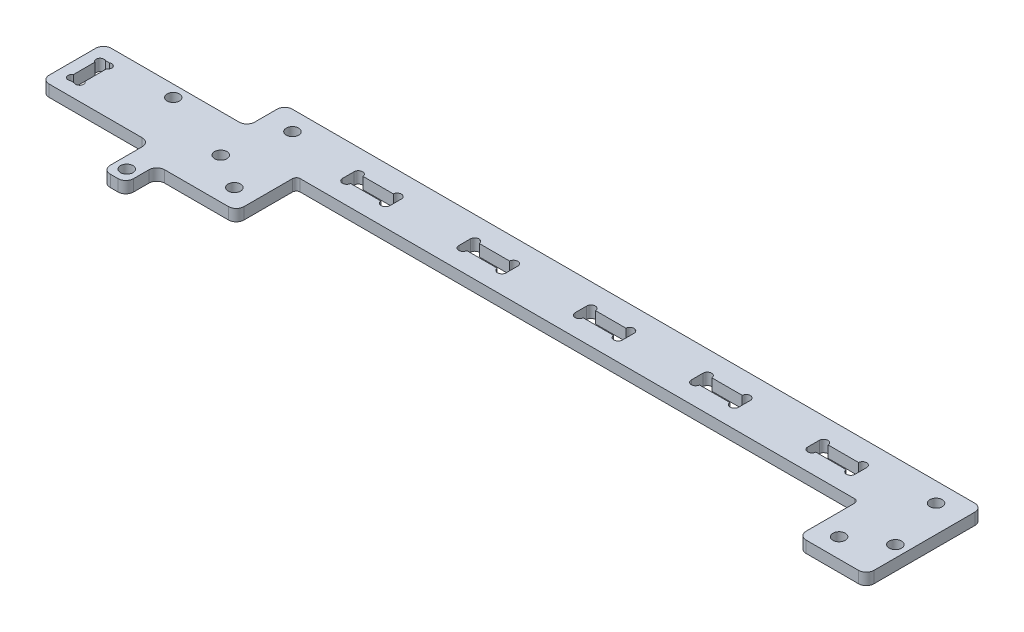
from build123d import *

# Parameters (mm, degrees)
SKETCH_1_R          = 1.6
EXTRUDE_1_DEPTH     = 3
SKETCH_3_R          = 1.6
CUT_EXTRUDE_1_DEPTH = 92.290744328
FILLET_1_R          = 1
SKETCH_4_W          = 12
SKETCH_4_H          = 3
CUT_EXTRUDE_2_DEPTH = 92.290744328
SKETCH_5_R          = 1
CUT_EXTRUDE_3_DEPTH = 92.290744328
CUT_EXTRUDE_4_DEPTH = 92.290744328
SKETCH_7_R          = 1.6
SKETCH_7_W          = 3
SKETCH_7_H          = 9
EXTRUDE_2_DEPTH     = 3
FILLET_3_R          = 2
SKETCH_8_R          = 1
CUT_EXTRUDE_5_DEPTH = 130.100735862


with BuildPart() as part:
    # 草图1 → 凸台-拉伸1 (new body)
    with BuildSketch(Plane(origin=(0, 0, 0), x_dir=(1, 0, 0), z_dir=(0, 1, 0))):
        Polygon((-90, -15), (-72.5, -15), (-72.5, 0.5), (72.5, 0.5), (72.5, -15), (90, -15), (90, 15), (-90, 15), align=None)
        with Locations(Location((78, -10, 0), (0, 0, 270))):
            Circle(SKETCH_1_R, mode=Mode.SUBTRACT)
        with Locations(Location((-78, -10, 0), (0, 0, 90))):
            Circle(SKETCH_1_R, mode=Mode.SUBTRACT)
        with Locations(Location((-83, 10, 0), (0, 0, 270))):
            Circle(SKETCH_1_R, mode=Mode.SUBTRACT)
        with Locations(Location((83, 10, 0), (0, 0, 90))):
            Circle(SKETCH_1_R, mode=Mode.SUBTRACT)
    extrude(amount=EXTRUDE_1_DEPTH)

    # 草图3 → 切除-拉伸1 (cut, through all)
    with BuildSketch(Plane(origin=(0, 3, 0), x_dir=(1, 0, 0), z_dir=(0, 1, 0))):
        with Locations(Location((87, -4.5, 0), (0, 0, 90))):
            Circle(SKETCH_3_R)
        with Locations(Location((-87, -4.5, 0), (0, 0, 270))):
            Circle(SKETCH_3_R)
    extrude(amount=-CUT_EXTRUDE_1_DEPTH, mode=Mode.SUBTRACT)

    # 圆角1
    fillet_1_edges = [part.edges().sort_by_distance(p)[0] for p in [
        (72.5, 1.5, -0.5),
        (-72.5, 1.5, -0.5),
    ]]
    fillet(fillet_1_edges, radius=FILLET_1_R)

    # 草图4 → 切除-拉伸2 (cut, through all)
    with BuildSketch(Plane.XZ):
        with Locations((60, -7.5)):
            Rectangle(SKETCH_4_W, SKETCH_4_H)
        with Locations((30, -7.5)):
            Rectangle(SKETCH_4_W, SKETCH_4_H)
        with Locations((0, -7.5)):
            Rectangle(SKETCH_4_W, SKETCH_4_H)
        with Locations((-30, -7.5)):
            Rectangle(SKETCH_4_W, SKETCH_4_H)
        with Locations((-60, -7.5)):
            Rectangle(SKETCH_4_W, SKETCH_4_H)
    extrude(amount=-CUT_EXTRUDE_2_DEPTH, mode=Mode.SUBTRACT)

    # 草图5 → 切除-拉伸3 (cut, through all)
    with BuildSketch(Plane.XZ):
        with Locations((65, -9)):
            Circle(SKETCH_5_R)
        with Locations((55, -9)):
            Circle(SKETCH_5_R)
        with Locations((55, -6)):
            Circle(SKETCH_5_R)
        with Locations((65, -6)):
            Circle(SKETCH_5_R)
        with Locations((35, -9)):
            Circle(SKETCH_5_R)
        with Locations((25, -9)):
            Circle(SKETCH_5_R)
        with Locations((25, -6)):
            Circle(SKETCH_5_R)
        with Locations((35, -6)):
            Circle(SKETCH_5_R)
        with Locations((5, -9)):
            Circle(SKETCH_5_R)
        with Locations((-5, -9)):
            Circle(SKETCH_5_R)
        with Locations((-5, -6)):
            Circle(SKETCH_5_R)
        with Locations((5, -6)):
            Circle(SKETCH_5_R)
        with Locations((-25, -9)):
            Circle(SKETCH_5_R)
        with Locations((-35, -9)):
            Circle(SKETCH_5_R)
        with Locations((-35, -6)):
            Circle(SKETCH_5_R)
        with Locations((-25, -6)):
            Circle(SKETCH_5_R)
        with Locations((-55, -9)):
            Circle(SKETCH_5_R)
        with Locations((-65, -9)):
            Circle(SKETCH_5_R)
        with Locations((-65, -6)):
            Circle(SKETCH_5_R)
        with Locations((-55, -6)):
            Circle(SKETCH_5_R)
    extrude(amount=-CUT_EXTRUDE_3_DEPTH, mode=Mode.SUBTRACT)

    # 草图6 → 切除-拉伸4 (cut, through all)
    with BuildSketch(Plane.XZ):
        with BuildLine():
            Line((36.1, -9), (36.1, -6))
            ThreePointArc((36.1, -6), (35.050051841, -4.901139311), (33.904554885, -5.9))
            Line((33.904554885, -5.9), (26.095445115, -5.9))
            ThreePointArc((26.095445115, -5.9), (24.949948159, -4.901139311), (23.9, -6))
            Line((23.9, -6), (23.9, -9))
            ThreePointArc((23.9, -9), (24.949948159, -10.098860689), (26.095445115, -9.1))
            Line((26.095445115, -9.1), (33.904554885, -9.1))
            ThreePointArc((33.904554885, -9.1), (35.050051841, -10.098860689), (36.1, -9))
        make_face()
        with BuildLine():
            Line((66.1, -9), (66.1, -6))
            ThreePointArc((66.1, -6), (65.050051841, -4.901139311), (63.904554885, -5.9))
            Line((63.904554885, -5.9), (56.095445115, -5.9))
            ThreePointArc((56.095445115, -5.9), (54.949948159, -4.901139311), (53.9, -6))
            Line((53.9, -6), (53.9, -9))
            ThreePointArc((53.9, -9), (54.949948159, -10.098860689), (56.095445115, -9.1))
            Line((56.095445115, -9.1), (63.904554885, -9.1))
            ThreePointArc((63.904554885, -9.1), (65.050051841, -10.098860689), (66.1, -9))
        make_face()
        with BuildLine():
            Line((6.1, -9), (6.1, -6))
            ThreePointArc((6.1, -6), (5.050051841, -4.901139311), (3.904554885, -5.9))
            Line((3.904554885, -5.9), (-3.904554885, -5.9))
            ThreePointArc((-3.904554885, -5.9), (-5.050051841, -4.901139311), (-6.1, -6))
            Line((-6.1, -6), (-6.1, -9))
            ThreePointArc((-6.1, -9), (-5.050051841, -10.098860689), (-3.904554885, -9.1))
            Line((-3.904554885, -9.1), (3.904554885, -9.1))
            ThreePointArc((3.904554885, -9.1), (5.050051841, -10.098860689), (6.1, -9))
        make_face()
        with BuildLine():
            Line((-23.9, -9), (-23.9, -6))
            ThreePointArc((-23.9, -6), (-24.949948159, -4.901139311), (-26.095445115, -5.9))
            Line((-26.095445115, -5.9), (-33.904554885, -5.9))
            ThreePointArc((-33.904554885, -5.9), (-35.050051841, -4.901139311), (-36.1, -6))
            Line((-36.1, -6), (-36.1, -9))
            ThreePointArc((-36.1, -9), (-35.050051841, -10.098860689), (-33.904554885, -9.1))
            Line((-33.904554885, -9.1), (-26.095445115, -9.1))
            ThreePointArc((-26.095445115, -9.1), (-24.949948159, -10.098860689), (-23.9, -9))
        make_face()
        with BuildLine():
            Line((-53.9, -9), (-53.9, -6))
            ThreePointArc((-53.9, -6), (-54.949948159, -4.901139311), (-56.095445115, -5.9))
            Line((-56.095445115, -5.9), (-63.904554885, -5.9))
            ThreePointArc((-63.904554885, -5.9), (-65.050051841, -4.901139311), (-66.1, -6))
            Line((-66.1, -6), (-66.1, -9))
            ThreePointArc((-66.1, -9), (-65.050051841, -10.098860689), (-63.904554885, -9.1))
            Line((-63.904554885, -9.1), (-56.095445115, -9.1))
            ThreePointArc((-56.095445115, -9.1), (-54.949948159, -10.098860689), (-53.9, -9))
        make_face()
    extrude(amount=-CUT_EXTRUDE_4_DEPTH, mode=Mode.SUBTRACT)

    # 草图7 → 凸台-拉伸2 (add)
    with BuildSketch(Plane.XZ):
        Polygon((-90, -5.25), (-90, 15), (-93, 15), (-93, 23), (-99, 23), (-99, 10.75), (-127, 10.75), (-127, -5.25), align=None)
        with Locations(Location((-96, 19.75, 0), (0, 0, 270))):
            Circle(SKETCH_7_R, mode=Mode.SUBTRACT)
        with Locations(Location((-106, -2.25, 0), (0, 0, 270))):
            Circle(SKETCH_7_R, mode=Mode.SUBTRACT)
        with Locations((-122.5, 2.75)):
            Rectangle(SKETCH_7_W, SKETCH_7_H, mode=Mode.SUBTRACT)
    extrude(amount=-EXTRUDE_2_DEPTH)

    # 圆角3
    fillet_3_edges = [part.edges().sort_by_distance(p)[0] for p in [
        (90, 1.5, 15),
        (72.5, 1.5, 15),
        (-72.5, 1.5, 15),
        (-90, 1.5, -15),
        (90, 1.5, -15),
        (-93, 1.5, 15),
        (-93, 1.5, 23),
        (-99, 1.5, 23),
        (-99, 1.5, 10.75),
        (-127, 1.5, 10.75),
        (-127, 1.5, -5.25),
        (-90, 1.5, -5.25),
    ]]
    fillet(fillet_3_edges, radius=FILLET_3_R)

    # 草图8 → 切除-拉伸5 (cut, through all)
    with BuildSketch(Plane(origin=(0, 3, 0), x_dir=(1, 0, 0), z_dir=(0, 1, 0))):
        with Locations((-123.5025, 0.882536024)):
            Circle(SKETCH_8_R)
        with Locations((-121.4975, 0.882536024)):
            Circle(SKETCH_8_R)
        with Locations((-121.4975, -6.382536024)):
            Circle(SKETCH_8_R)
        with Locations((-123.5025, -6.382536024)):
            Circle(SKETCH_8_R)
    extrude(amount=-CUT_EXTRUDE_5_DEPTH, mode=Mode.SUBTRACT)


solid = part.part
